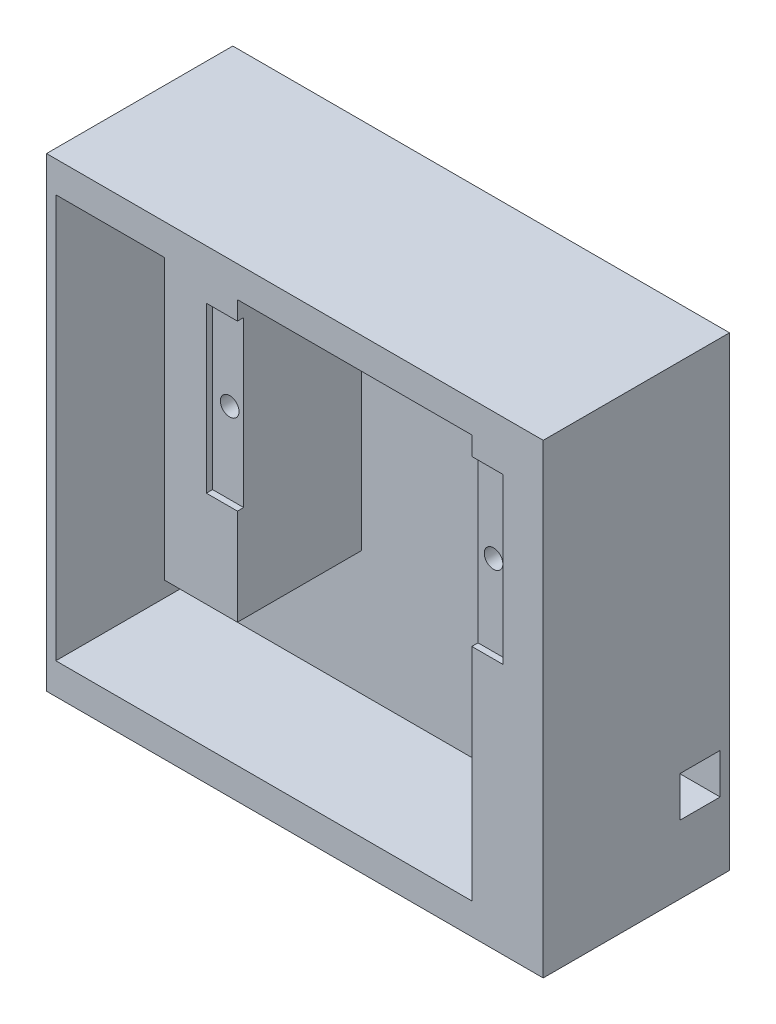
from build123d import *

# Parameters (mm, degrees)
SKETCH2_W           = 160
SKETCH2_H           = 150
BOSS_EXTRUDE1_DEPTH = 60
CUT_EXTRUDE1_DEPTH  = 40
SKETCH4_R           = 3
CUT_EXTRUDE2_DEPTH  = 40
SKETCH5_W           = 13
SKETCH5_H           = 13
CUT_EXTRUDE3_DEPTH  = 23
SKETCH6_W           = 10
SKETCH6_H           = 53
CUT_EXTRUDE4_DEPTH  = 2
SKETCH7_W           = 35
SKETCH7_H           = 130
CUT_EXTRUDE5_DEPTH  = 40


with BuildPart() as part:
    # Sketch2 → Boss-Extrude1 (new body)
    with BuildSketch(Plane.XY):
        with Locations((-80, -75)):
            Rectangle(SKETCH2_W, SKETCH2_H)
    extrude(amount=BOSS_EXTRUDE1_DEPTH)

    # Sketch3 → Cut-Extrude1 (cut)
    with BuildSketch(Plane.XY.offset(60)):
        Polygon((-98.5, -10), (-23, -10), (-23, -140), (-157, -140), (-157, -100), (-98.5, -100), align=None)
    extrude(amount=-CUT_EXTRUDE1_DEPTH, mode=Mode.SUBTRACT)

    # Sketch4 → Cut-Extrude2 (cut)
    with BuildSketch(Plane.XY.offset(60)):
        with Locations((-103, -43)):
            Circle(SKETCH4_R)
        with Locations((-18, -43)):
            Circle(SKETCH4_R)
    extrude(amount=-CUT_EXTRUDE2_DEPTH, mode=Mode.SUBTRACT)

    # Sketch5 → Cut-Extrude3 (cut)
    with BuildSketch(Plane(origin=(0, 0, 0), x_dir=(0, 0, -1), z_dir=(1, 0, 0))):
        with Locations((-9.5, -121.5)):
            Rectangle(SKETCH5_W, SKETCH5_H)
    extrude(amount=-CUT_EXTRUDE3_DEPTH, mode=Mode.SUBTRACT)

    # Sketch6 → Cut-Extrude4 (cut)
    with BuildSketch(Plane.XY.offset(60)):
        with Locations((-103.5, -42.5)):
            Rectangle(SKETCH6_W, SKETCH6_H)
        with Locations((-18, -42.5)):
            Rectangle(SKETCH6_W, SKETCH6_H)
    extrude(amount=-CUT_EXTRUDE4_DEPTH, mode=Mode.SUBTRACT)

    # Sketch7 → Cut-Extrude5 (cut)
    with BuildSketch(Plane.XY.offset(60)):
        with Locations((-139.5, -75)):
            Rectangle(SKETCH7_W, SKETCH7_H)
    extrude(amount=-CUT_EXTRUDE5_DEPTH, mode=Mode.SUBTRACT)


solid = part.part
